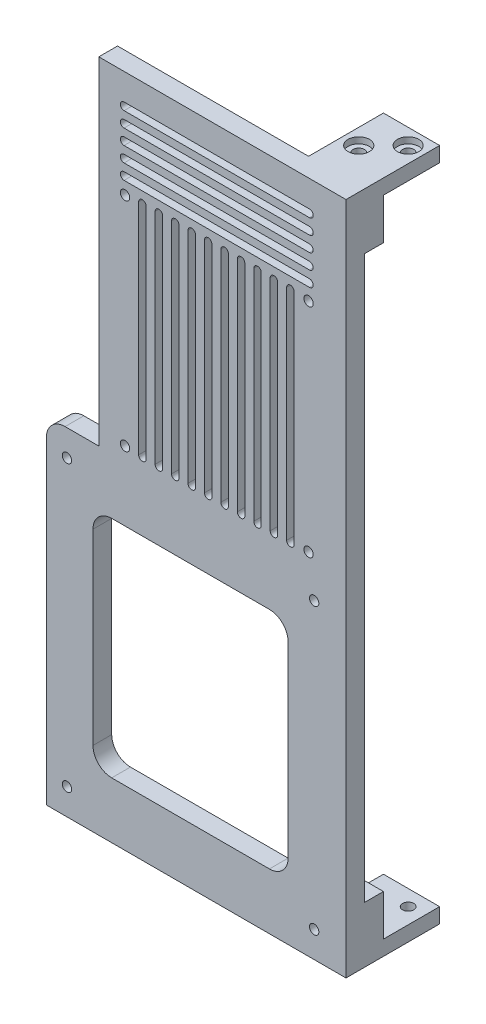
from build123d import *

# Parameters (mm, degrees)
CROQUIS1_R              = 1.25
SALIENTE_EXTRUIR2_DEPTH = 10
CROQUIS2_W              = 15
CROQUIS2_H              = 15
CROQUIS2_R              = 1.5
SALIENTE_EXTRUIR3_DEPTH = 4
CROQUIS3_R              = 2.85
CORTAR_EXTRUIR1_DEPTH   = 1.65
CORTAR_EXTRUIR2_REACH   = 173.683
CROQUIS4_W              = 4
CROQUIS4_H              = 10
CORTAR_EXTRUIR3_REACH   = 105.682
REDONDEO1_R             = 5
CORTAR_EXTRUIR5_DEPTH   = 5
CROQUIS8_W              = 52.105263158
CROQUIS8_H              = 60
CORTAR_EXTRUIR6_DEPTH   = 5
REDONDEO2_R             = 5


with BuildPart() as part:
    # Croquis1 → Saliente-Extruir2 (new body)
    with BuildSketch(Plane.XY):
        Polygon((-45, -90), (41, -90), (41, -75), (45, -75), (45, 75), (41, 75), (41, 90), (-45, 90), align=None)
        with Locations((-33.5, -83)):
            Circle(CROQUIS1_R, mode=Mode.SUBTRACT)
        with Locations((-33.5, -7)):
            Circle(CROQUIS1_R, mode=Mode.SUBTRACT)
        with Locations((32.5, -83)):
            Circle(CROQUIS1_R, mode=Mode.SUBTRACT)
        with Locations((32.5, -7)):
            Circle(CROQUIS1_R, mode=Mode.SUBTRACT)
        with Locations((-18, 3.533333333)):
            Circle(CROQUIS1_R, mode=Mode.SUBTRACT)
        with BuildLine():
            ThreePointArc((-14.3581, 61.783333333), (-13.3581, 62.783333333), (-12.3581, 61.783333333))
            Line((-12.3581, 61.783333333), (-12.3581, 3.283333333))
            ThreePointArc((-12.3581, 3.283333333), (-13.3581, 2.283333333), (-14.3581, 3.283333333))
            Line((-14.3581, 3.283333333), (-14.3581, 61.783333333))
        make_face(mode=Mode.SUBTRACT)
        with BuildLine():
            ThreePointArc((-9.9681, 61.783333333), (-8.9681, 62.783333333), (-7.9681, 61.783333333))
            Line((-7.9681, 61.783333333), (-7.9681, 3.283333333))
            ThreePointArc((-7.9681, 3.283333333), (-8.9681, 2.283333333), (-9.9681, 3.283333333))
            Line((-9.9681, 3.283333333), (-9.9681, 61.783333333))
        make_face(mode=Mode.SUBTRACT)
        with BuildLine():
            ThreePointArc((-5.5781, 61.783333333), (-4.5781, 62.783333333), (-3.5781, 61.783333333))
            Line((-3.5781, 61.783333333), (-3.5781, 3.283333333))
            ThreePointArc((-3.5781, 3.283333333), (-4.5781, 2.283333333), (-5.5781, 3.283333333))
            Line((-5.5781, 3.283333333), (-5.5781, 61.783333333))
        make_face(mode=Mode.SUBTRACT)
        with BuildLine():
            Line((-27.5, 81.033333333), (-27.5, 4))
            ThreePointArc((-27.5, 4), (-31.5, 0), (-35.5, 4))
            Line((-35.5, 4), (-35.5, 81.033333333))
            ThreePointArc((-35.5, 81.033333333), (-31.5, 85.033333333), (-27.5, 81.033333333))
        make_face(mode=Mode.SUBTRACT)
        with Locations((-18, 61.533333333)):
            Circle(CROQUIS1_R, mode=Mode.SUBTRACT)
        with BuildLine():
            ThreePointArc((-1.1881, 61.783333333), (-0.1881, 62.783333333), (0.8119, 61.783333333))
            Line((0.8119, 61.783333333), (0.8119, 3.283333333))
            ThreePointArc((0.8119, 3.283333333), (-0.1881, 2.283333333), (-1.1881, 3.283333333))
            Line((-1.1881, 3.283333333), (-1.1881, 61.783333333))
        make_face(mode=Mode.SUBTRACT)
        with BuildLine():
            ThreePointArc((3.2019, 61.783333333), (4.2019, 62.783333333), (5.2019, 61.783333333))
            Line((5.2019, 61.783333333), (5.2019, 3.283333333))
            ThreePointArc((5.2019, 3.283333333), (4.2019, 2.283333333), (3.2019, 3.283333333))
            Line((3.2019, 3.283333333), (3.2019, 61.783333333))
        make_face(mode=Mode.SUBTRACT)
        with BuildLine():
            ThreePointArc((7.5919, 61.783333333), (8.5919, 62.783333333), (9.5919, 61.783333333))
            Line((9.5919, 61.783333333), (9.5919, 3.283333333))
            ThreePointArc((9.5919, 3.283333333), (8.5919, 2.283333333), (7.5919, 3.283333333))
            Line((7.5919, 3.283333333), (7.5919, 61.783333333))
        make_face(mode=Mode.SUBTRACT)
        with BuildLine():
            ThreePointArc((11.9819, 61.783333333), (12.9819, 62.783333333), (13.9819, 61.783333333))
            Line((13.9819, 61.783333333), (13.9819, 3.283333333))
            ThreePointArc((13.9819, 3.283333333), (12.9819, 2.283333333), (11.9819, 3.283333333))
            Line((11.9819, 3.283333333), (11.9819, 61.783333333))
        make_face(mode=Mode.SUBTRACT)
        with Locations((31, 3.533333333)):
            Circle(CROQUIS1_R, mode=Mode.SUBTRACT)
        with BuildLine():
            Line((18.3719, 61.783333333), (18.3719, 3.283333333))
            ThreePointArc((18.3719, 3.283333333), (17.3719, 2.283333333), (16.3719, 3.283333333))
            Line((16.3719, 3.283333333), (16.3719, 61.783333333))
            ThreePointArc((16.3719, 61.783333333), (17.3719, 62.783333333), (18.3719, 61.783333333))
        make_face(mode=Mode.SUBTRACT)
        with BuildLine():
            Line((22.7619, 61.783333333), (22.7619, 3.283333333))
            ThreePointArc((22.7619, 3.283333333), (21.7619, 2.283333333), (20.7619, 3.283333333))
            Line((20.7619, 3.283333333), (20.7619, 61.783333333))
            ThreePointArc((20.7619, 61.783333333), (21.7619, 62.783333333), (22.7619, 61.783333333))
        make_face(mode=Mode.SUBTRACT)
        with BuildLine():
            Line((27.1519, 61.783333333), (27.1519, 3.283333333))
            ThreePointArc((27.1519, 3.283333333), (26.1519, 2.283333333), (25.1519, 3.283333333))
            Line((25.1519, 3.283333333), (25.1519, 61.783333333))
            ThreePointArc((25.1519, 61.783333333), (26.1519, 62.783333333), (27.1519, 61.783333333))
        make_face(mode=Mode.SUBTRACT)
        with BuildLine():
            ThreePointArc((-18.25, 64.808333333), (-19.25, 65.808333333), (-18.25, 66.808333333))
            Line((-18.25, 66.808333333), (31.25, 66.808333333))
            ThreePointArc((31.25, 66.808333333), (32.25, 65.808333333), (31.25, 64.808333333))
            Line((31.25, 64.808333333), (-18.25, 64.808333333))
        make_face(mode=Mode.SUBTRACT)
        with BuildLine():
            ThreePointArc((-18.25, 68.838333333), (-19.25, 69.838333333), (-18.25, 70.838333333))
            Line((-18.25, 70.838333333), (31.25, 70.838333333))
            ThreePointArc((31.25, 70.838333333), (32.25, 69.838333333), (31.25, 68.838333333))
            Line((31.25, 68.838333333), (-18.25, 68.838333333))
        make_face(mode=Mode.SUBTRACT)
        with BuildLine():
            ThreePointArc((-18.25, 72.868333333), (-19.25, 73.868333333), (-18.25, 74.868333333))
            Line((-18.25, 74.868333333), (31.25, 74.868333333))
            ThreePointArc((31.25, 74.868333333), (32.25, 73.868333333), (31.25, 72.868333333))
            Line((31.25, 72.868333333), (-18.25, 72.868333333))
        make_face(mode=Mode.SUBTRACT)
        with BuildLine():
            ThreePointArc((-18.25, 76.898333333), (-19.25, 77.898333333), (-18.25, 78.898333333))
            Line((-18.25, 78.898333333), (31.25, 78.898333333))
            ThreePointArc((31.25, 78.898333333), (32.25, 77.898333333), (31.25, 76.898333333))
            Line((31.25, 76.898333333), (-18.25, 76.898333333))
        make_face(mode=Mode.SUBTRACT)
        with BuildLine():
            Line((-18.25, 82.928333333), (31.25, 82.928333333))
            ThreePointArc((31.25, 82.928333333), (32.25, 81.928333333), (31.25, 80.928333333))
            Line((31.25, 80.928333333), (-18.25, 80.928333333))
            ThreePointArc((-18.25, 80.928333333), (-19.25, 81.928333333), (-18.25, 82.928333333))
        make_face(mode=Mode.SUBTRACT)
        with Locations((31, 61.533333333)):
            Circle(CROQUIS1_R, mode=Mode.SUBTRACT)
    extrude(amount=SALIENTE_EXTRUIR2_DEPTH)

    # Croquis2 → Saliente-Extruir3 (add)
    with BuildSketch(Plane.XZ.offset(90)):
        with Locations((33.5, -7.5)):
            Rectangle(CROQUIS2_W, CROQUIS2_H)
        with Locations((36.8, -10.8)):
            Circle(CROQUIS2_R, mode=Mode.SUBTRACT)
        with Locations((30.2, -4.2)):
            Circle(CROQUIS2_R, mode=Mode.SUBTRACT)
    saliente_extruir3 = extrude(amount=-SALIENTE_EXTRUIR3_DEPTH)

    # Croquis3 → Cortar-Extruir1 (cut)
    with BuildSketch(Plane.XZ.offset(90)):
        with Locations(Location((30.2, -4.2, 0), (0, 0, 270))):
            Circle(CROQUIS3_R)
        with Locations(Location((36.8, -10.8, 0), (0, 0, 270))):
            Circle(CROQUIS3_R)
    cortar_extruir1 = extrude(amount=-CORTAR_EXTRUIR1_DEPTH, mode=Mode.SUBTRACT)

    # Simetría2: Saliente-Extruir3, Cortar-Extruir1 across plane
    add(saliente_extruir3.mirror(Plane.ZX))
    add(cortar_extruir1.mirror(Plane.ZX), mode=Mode.SUBTRACT)

    # Croquis4 → Cortar-Extruir2 (cut, up to next)
    with BuildSketch(Plane(origin=(0, 75, 0), x_dir=(1, 0, 0), z_dir=(0, 1, 0)), mode=Mode.PRIVATE) as cortar_extruir2_sk1:
        with Locations((43, -5)):
            Rectangle(CROQUIS4_W, CROQUIS4_H)
    cortar_extruir2_tool1 = extrude(cortar_extruir2_sk1.sketch, amount=-CORTAR_EXTRUIR2_REACH, mode=Mode.PRIVATE) & part.part
    add(cortar_extruir2_tool1.solids().sort_by_distance((43, 75, 5))[0], mode=Mode.SUBTRACT)

    # Croquis5 → Cortar-Extruir3 (cut, up to next)
    with BuildSketch(Plane.XY.offset(10), mode=Mode.PRIVATE) as cortar_extruir3_sk1:
        Polygon((-45, 90), (-25, 90), (-25, 0), (-39, 0), (-39, -90), (-45, -90), (-45, 0), align=None)
    cortar_extruir3_tool1 = extrude(cortar_extruir3_sk1.sketch, amount=-CORTAR_EXTRUIR3_REACH, mode=Mode.PRIVATE) & part.part
    add(cortar_extruir3_tool1.solids().sort_by_distance((-36.615385, 24.230769, 10))[0], mode=Mode.SUBTRACT)

    # Redondeo1
    redondeo1_edges = [part.edges().sort_by_distance(p)[0] for p in [
        (-39, 0, 5),
    ]]
    fillet(redondeo1_edges, radius=REDONDEO1_R)

    # Croquis7 → Cortar-Extruir5 (cut)
    with BuildSketch(Plane(origin=(0, 0, 0), x_dir=(-1, 0, 0), z_dir=(0, 0, -1))):
        Polygon((39, -75), (39, -90), (-26, -90), (-26, -75), (-41, -75), (-41, 75), (-26, 75), (-26, 90), (39, 90), (39, 75), align=None)
    extrude(amount=-CORTAR_EXTRUIR5_DEPTH, mode=Mode.SUBTRACT)

    # Croquis8 → Cortar-Extruir6 (cut)
    with BuildSketch(Plane.XY.offset(10)):
        with Locations((-0.5, -45)):
            Rectangle(CROQUIS8_W, CROQUIS8_H)
    extrude(amount=-CORTAR_EXTRUIR6_DEPTH, mode=Mode.SUBTRACT)

    # Redondeo2
    redondeo2_edges = [part.edges().sort_by_distance(p)[0] for p in [
        (-26.552631579, -75, 7.5),
        (-26.552631579, -15, 7.5),
        (25.552631579, -15, 7.5),
        (25.552631579, -75, 7.5),
    ]]
    fillet(redondeo2_edges, radius=REDONDEO2_R)


solid = part.part
